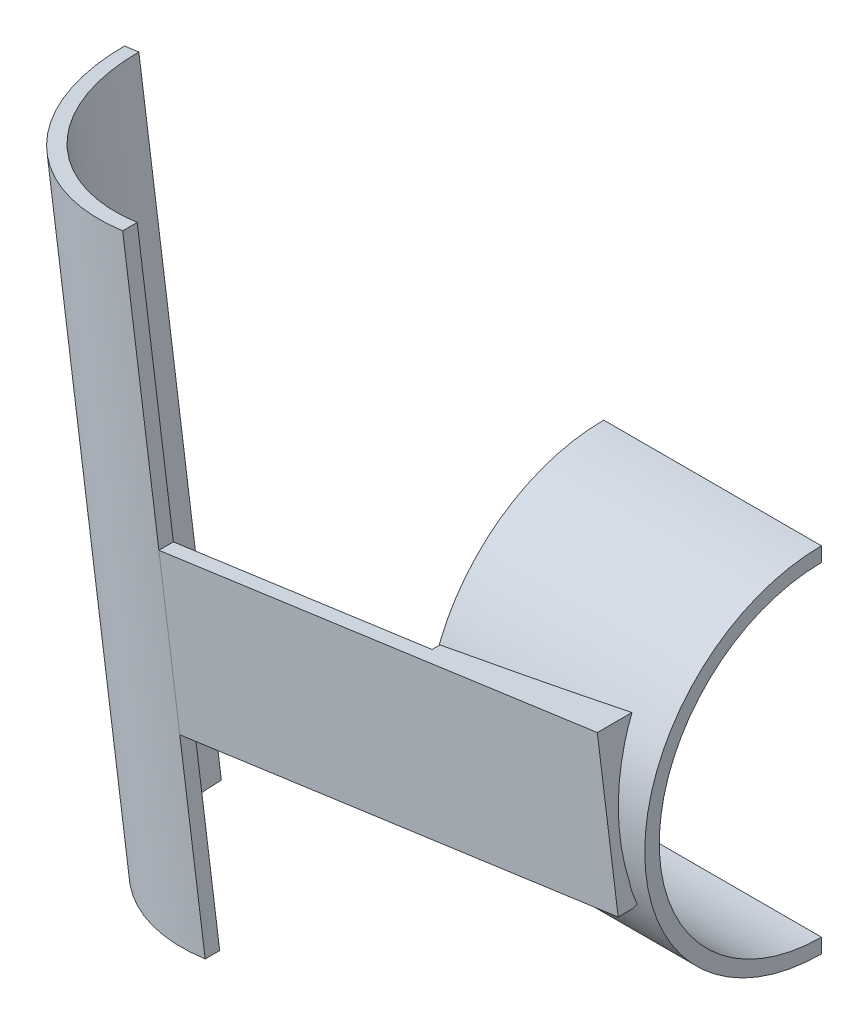
from build123d import *

# Parameters (mm, degrees)
SKETCH3_R               = 25.75
SKETCH3_R_2             = 23.75
BOSS_EXTRUDE1_DEPTH     = 82
SKETCH2_R               = 24.35
SKETCH2_R_2             = 22.35
BOSS_EXTRUDE2_DEPTH     = 30
CUT_EXTRUDE1_DEPTH      = 30
CUT_EXTRUDE1_DEPTH_BACK = 30
SKETCH5_W               = 101.816386604
SKETCH5_H               = 90.816460778
CUT_EXTRUDE2_DEPTH      = 30
SKETCH6_W               = 2
SKETCH6_H               = 20.775230247
BOSS_EXTRUDE3_DEPTH     = 61
BOSS_EXTRUDE5_DEPTH     = 25


with BuildPart() as part:
    # Sketch3 → Boss-Extrude1 (new body)
    with BuildSketch(Plane(origin=(-103.870896529, 742.017814767, 0), x_dir=(-0.9903438719336157, -0.13863266326351154, 0), z_dir=(0.13863266326351156, -0.9903438719336158, 0))):
        with Locations((-535.354479902, 0)):
            Circle(SKETCH3_R)
        with Locations((-535.354479902, 0)):
            Circle(SKETCH3_R_2, mode=Mode.SUBTRACT)
    extrude(amount=-BOSS_EXTRUDE1_DEPTH)

    # Sketch4 → Cut-Extrude1 (cut, two sides: drawn at the far end of the back side and taken through both)
    with BuildSketch(Plane.XY.offset(-CUT_EXTRUDE1_DEPTH_BACK)):
        Polygon((414.924769966, 897.597101018), (426.314131953, 816.235432106), (451.815486656, 819.805223185), (440.426124669, 901.166892097), align=None)
    extrude(amount=CUT_EXTRUDE1_DEPTH + CUT_EXTRUDE1_DEPTH_BACK, mode=Mode.SUBTRACT)


with BuildPart() as body_2:
    # Sketch2 → Boss-Extrude2 (new body)
    with BuildSketch(Plane(origin=(455.481917253, 0, 0), x_dir=(0, 0, -1), z_dir=(1, 0, 0))):
        with Locations((0, 857.898759871)):
            Circle(SKETCH2_R)
        with Locations((0, 857.898759871)):
            Circle(SKETCH2_R_2, mode=Mode.SUBTRACT)
    extrude(amount=BOSS_EXTRUDE2_DEPTH)


with BuildPart() as cut_extrude2_tool:
    # Sketch5 → Cut-Extrude2 (new body)
    with BuildSketch(Plane.XY):
        with Locations((437.415428166, 854.729783017)):
            Rectangle(SKETCH5_W, SKETCH5_H)
    extrude(amount=-CUT_EXTRUDE2_DEPTH)


with BuildPart() as part_1:
    add(part.part)

    # Cut-Extrude2: cut by cut_extrude2_tool
    add(cut_extrude2_tool.part, mode=Mode.SUBTRACT)



with BuildPart() as body_2_1:
    add(body_2.part)

    # Cut-Extrude2: cut by cut_extrude2_tool
    add(cut_extrude2_tool.part, mode=Mode.SUBTRACT)


with BuildPart() as part_2:
    add(part_1.part)

    add(body_2_1.part)  # Boss-Extrude3 merges body 2
    # Sketch6 → Boss-Extrude3 (add)
    with BuildSketch(Plane(origin=(530.185028483, 74.217617339, 0), x_dir=(0, 0, -1), z_dir=(0.9903438719336157, 0.13863266326351165, 0))):
        with Locations((-24.75, 784.889811472)):
            Rectangle(SKETCH6_W, SKETCH6_H)
    extrude(amount=BOSS_EXTRUDE3_DEPTH)

    # Sketch7 → Boss-Extrude5 (add)
    with BuildSketch(Plane(origin=(590.596004671, 82.674209798, 0), x_dir=(0, 0, -1), z_dir=(0.9903438719336163, 0.1386326632635082, 0))):
        with BuildLine():
            Line((-23.107264421, 774.705646561), (-23.75, 774.502196348))
            Line((-23.75, 774.502196348), (-25.75, 774.502196348))
            Line((-25.75, 774.502196348), (-25.75, 795.277426595))
            Line((-25.75, 795.277426595), (-20.530540655, 795.277426595))
            ThreePointArc((-20.530540655, 795.277426595), (-24.164463247, 785.285330407), (-23.107264421, 774.705646561))
        make_face()
    extrude(amount=-BOSS_EXTRUDE5_DEPTH)


solid = part_2.part
